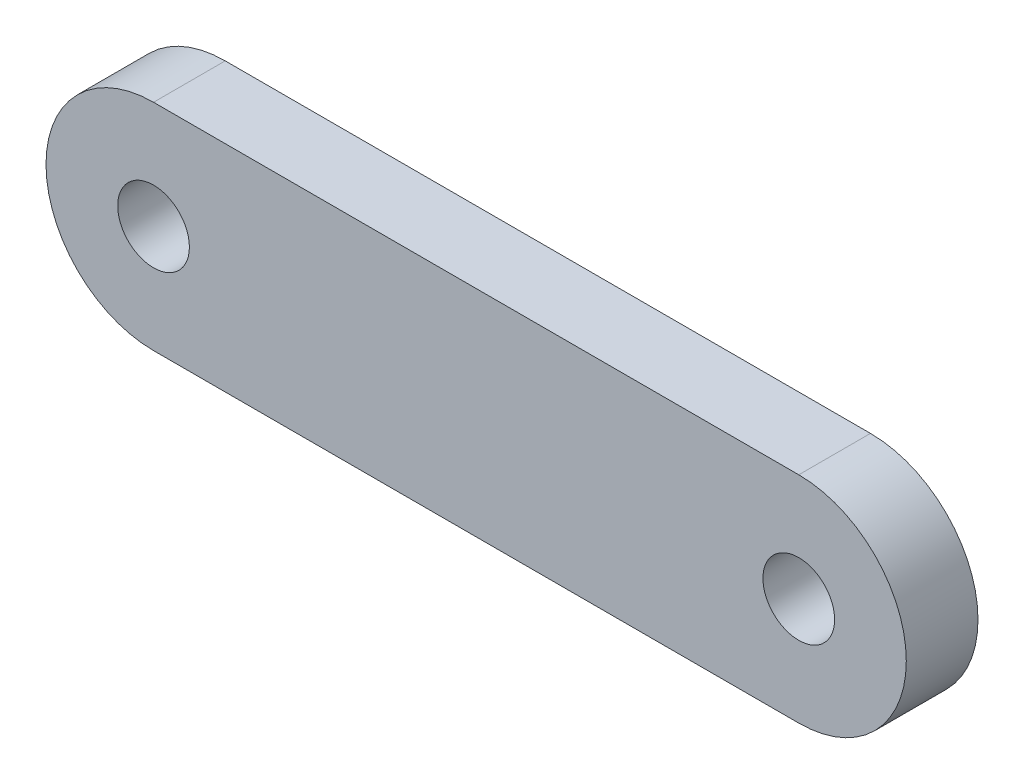
from build123d import *

# Parameters (mm, degrees)
SKETCH1_R           = 5
BOSS_EXTRUDE1_DEPTH = 10


with BuildPart() as part:
    # Sketch1 → Boss-Extrude1 (new body)
    with BuildSketch(Plane.XY):
        with BuildLine():
            Line((-45, 15), (45, 15))
            ThreePointArc((45, 15), (60, 0), (45, -15))
            Line((45, -15), (-45, -15))
            ThreePointArc((-45, -15), (-60, 0), (-45, 15))
        make_face()
        with Locations((-45, 0)):
            Circle(SKETCH1_R, mode=Mode.SUBTRACT)
        with Locations((45, 0)):
            Circle(SKETCH1_R, mode=Mode.SUBTRACT)
    extrude(amount=BOSS_EXTRUDE1_DEPTH)


solid = part.part
